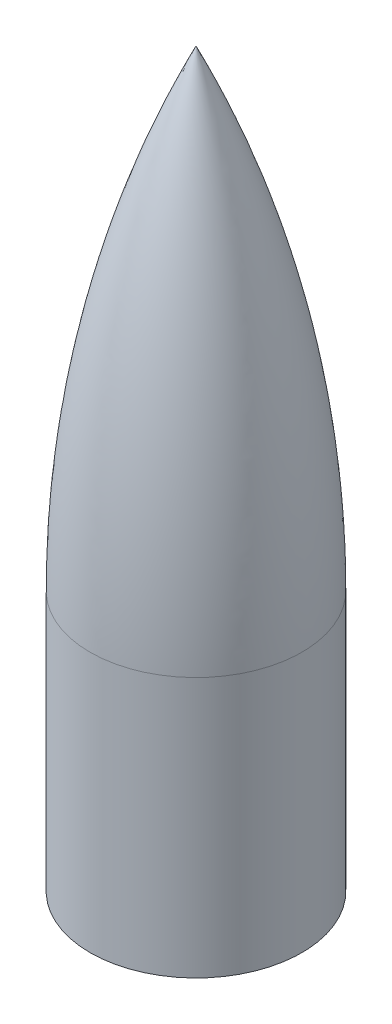
from build123d import *


with BuildPart() as part:
    # Esquisse1 → Révolution1 (revolve)
    with BuildSketch(Plane.XY):
        with BuildLine():
            Line((0, 0), (-2.85, 0))
            Line((-2.85, 0), (-2.85, 7))
            ThreePointArc((-2.85, 7), (-2.128748699, 13.507927858), (0, 19.7))
            Line((0, 19.7), (0, 0))
        make_face()
    revolve(axis=Axis((0, 0, 0), (0, 1, 0)))


solid = part.part
